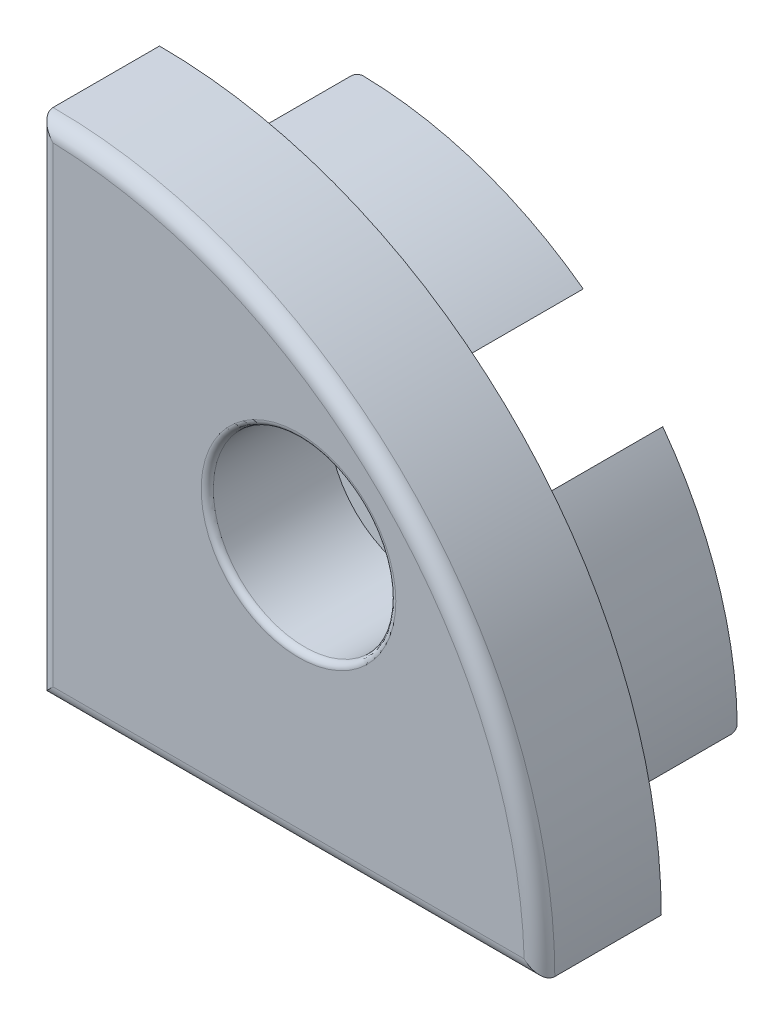
from build123d import *

# Parameters (mm, degrees)
BOSS_EXTRUDE2_DEPTH = 4
FILLET1_R           = 0.5
BOSS_EXTRUDE3_DEPTH = 5
EXTRUDE_THIN1_DEPTH = 5
FILLET5_R           = 0.5
FILLET6_R           = 0.2
FILLET7_R           = 0.2
SKETCH4_R           = 3
CUT_EXTRUDE1_DEPTH  = 7.5
FILLET8_R           = 0.2


with BuildPart() as part:
    # Sketch1 → Boss-Extrude2 (new body)
    with BuildSketch(Plane.XY):
        with BuildLine():
            Line((0, 16.5), (0, 0))
            Line((0, 0), (16.5, 0))
            ThreePointArc((16.5, 0), (11.66726189, 11.66726189), (0, 16.5))
        make_face()
    extrude(amount=-BOSS_EXTRUDE2_DEPTH)

    # Fillet1
    fillet1_edges = [part.edges().sort_by_distance(p)[0] for p in [
        (8.25, 0, 0),
        (0, 8.25, 0),
        (11.66726189, 11.66726189, 0),
    ]]
    fillet(fillet1_edges, radius=FILLET1_R)

    # Sketch2 → Boss-Extrude3 (add)
    with BuildSketch(Plane(origin=(0, 0, -4), x_dir=(-1, 0, 0), z_dir=(0, 0, -1))):
        with BuildLine():
            Line((-1.5, 14), (-1.5, 11.5))
            ThreePointArc((-1.5, 11.5), (-8.571067812, 8.571067812), (-11.5, 1.5))
            Line((-11.5, 1.5), (-14, 1.5))
            ThreePointArc((-14, 1.5), (-10.338834765, 10.338834765), (-1.5, 14))
        make_face()
    extrude(amount=BOSS_EXTRUDE3_DEPTH)

    # Fillet6
    fillet6_edges = [part.edges().sort_by_distance(p)[0] for p in [
        (1.5, 12.75, -9),
        (12.75, 1.5, -9),
    ]]
    fillet(fillet6_edges, radius=FILLET6_R)

    # Sketch4 → Cut-Extrude1 (cut, symmetric)
    with BuildSketch(Plane(origin=(0, 0, -4), x_dir=(-1, 0, 0), z_dir=(0, 0, -1))):
        with Locations((-8.571067812, 8.571067812)):
            Circle(SKETCH4_R)
    extrude(amount=CUT_EXTRUDE1_DEPTH, both=True, mode=Mode.SUBTRACT)

    # Fillet8
    fillet8_edges = [part.edges().sort_by_distance(p)[0] for p in [
        (11.571067812, 8.571067812, 0),
    ]]
    fillet(fillet8_edges, radius=FILLET8_R)


with BuildPart() as body_2:
    # Sketch2<3> → Extrude-Thin1 (new body)
    with BuildSketch(Plane(origin=(0, 0, -4), x_dir=(-1, 0, 0), z_dir=(0, 0, -1))):
        Polygon((-1, 1), (-1, 8.003336572), (-8.003336572, 1), align=None)
        Polygon((-1.5, 1.5), (-1.5, 6.796229791), (-6.796229791, 1.5), align=None, mode=Mode.SUBTRACT)
    extrude(amount=EXTRUDE_THIN1_DEPTH)

    # Fillet5
    fillet5_edges = [body_2.edges().sort_by_distance(p)[0] for p in [
        (1, 1, -6.5),
        (1, 8.003336572, -6.5),
        (8.003336572, 1, -6.5),
    ]]
    fillet(fillet5_edges, radius=FILLET5_R)

    # Fillet7
    fillet7_edges = [body_2.edges().sort_by_distance(p)[0] for p in [
        (7.258169557, 1.308658284, -9),
        (4.501668286, 4.501668286, -9),
        (1.308658284, 7.258169557, -9),
        (1, 4.148114896, -9),
        (1.146446609, 1.146446609, -9),
        (4.148114896, 1, -9),
    ]]
    fillet(fillet7_edges, radius=FILLET7_R)


solid = Compound([part.part, body_2.part])
